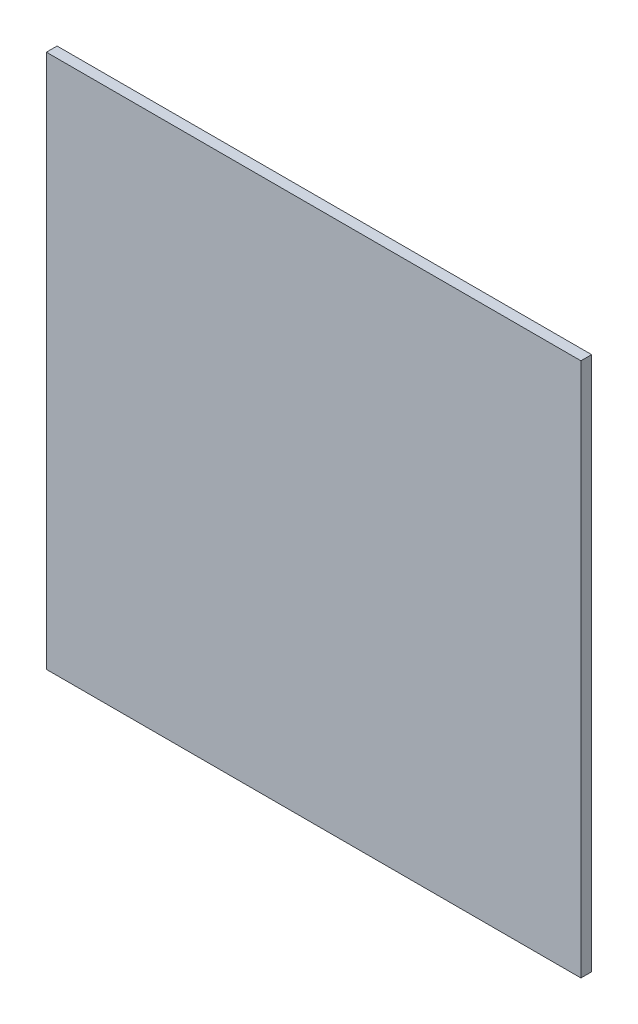
from build123d import *

# Parameters (mm, degrees)
SKETCH_1_W      = 100
SKETCH_1_H      = 100
EXTRUDE_2_DEPTH = 2


with BuildPart() as part:
    # 草图1 → 凸台-拉伸2 (new body)
    with BuildSketch(Plane.XY):
        with Locations((-2.780565888, -6.664744511)):
            Rectangle(SKETCH_1_W, SKETCH_1_H)
    extrude(amount=EXTRUDE_2_DEPTH)


solid = part.part
